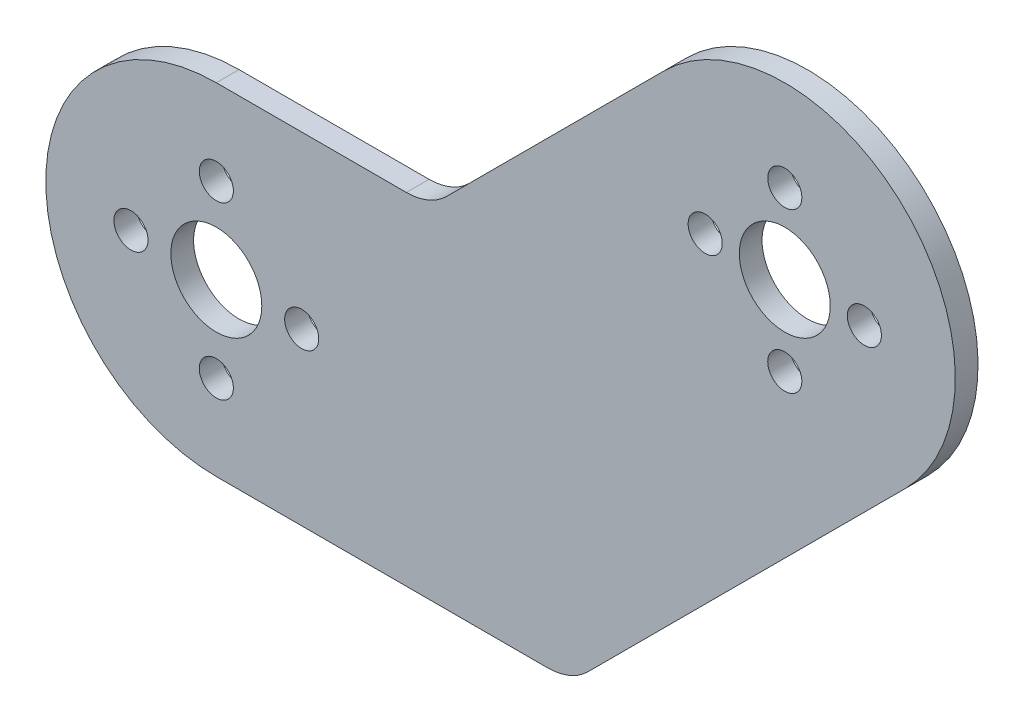
from build123d import *

# Parameters (mm, degrees)
SALIENTE_EXTRUIR1_DEPTH = 2
CROQUIS1_R              = 4
CORTAR_EXTRUIR1_DEPTH   = 2
CROQUIS2_R              = 1.5
CORTAR_EXTRUIR2_DEPTH   = 2
MATRIZC1_COUNT          = 4
CROQUIS4_R              = 4
CORTAR_EXTRUIR3_DEPTH   = 2
CROQUIS5_R              = 1.5
CORTAR_EXTRUIR4_DEPTH   = 2
MATRIZC2_COUNT          = 4


with BuildPart() as part:
    # Croquis3 → Saliente-Extruir1 (new body)
    with BuildSketch(Plane.XY):
        with BuildLine():
            Line((0, 15), (16.715728753, 15))
            ThreePointArc((16.715728753, 15), (18.629145914, 15.380602337), (20.251262658, 16.464466094))
            Line((20.251262658, 16.464466094), (39.393398282, 35.606601717))
            ThreePointArc((39.393398282, 35.606601717), (60.606601717, 35.606601717), (60.606601717, 14.393398282))
            Line((60.606601717, 14.393398282), (32.67766953, -13.535533906))
            ThreePointArc((32.67766953, -13.535533906), (31.055552786, -14.619397663), (29.142135624, -15))
            Line((29.142135624, -15), (0, -15))
            ThreePointArc((0, -15), (-15, 0), (0, 15))
        make_face()
    extrude(amount=SALIENTE_EXTRUIR1_DEPTH)

    # Croquis1 → Cortar-Extruir1 (cut)
    with BuildSketch(Plane.XY):
        Circle(CROQUIS1_R)
    extrude(amount=CORTAR_EXTRUIR1_DEPTH, mode=Mode.SUBTRACT)

    # Croquis2 → Cortar-Extruir2 (cut)
    with BuildSketch(Plane.XY):
        with Locations((0, 7.509798768)):
            Circle(CROQUIS2_R)
    cortar_extruir2 = extrude(amount=CORTAR_EXTRUIR2_DEPTH, mode=Mode.SUBTRACT)

    # MatrizC1: Cortar-Extruir2 ×4 about axis
    matrizc1_axis = Axis((0, 0, 0), (0, 0, 1))
    for i in range(1, MATRIZC1_COUNT):
        add(cortar_extruir2.rotate(matrizc1_axis, i * 360 / MATRIZC1_COUNT), mode=Mode.SUBTRACT)

    # Croquis4 → Cortar-Extruir3 (cut)
    with BuildSketch(Plane.XY.offset(2)):
        with Locations((50, 25)):
            Circle(CROQUIS4_R)
    extrude(amount=-CORTAR_EXTRUIR3_DEPTH, mode=Mode.SUBTRACT)

    # Croquis5 → Cortar-Extruir4 (cut)
    with BuildSketch(Plane.XY.offset(2)):
        with Locations((50, 32)):
            Circle(CROQUIS5_R)
    cortar_extruir4 = extrude(amount=-CORTAR_EXTRUIR4_DEPTH, mode=Mode.SUBTRACT)

    # MatrizC2: Cortar-Extruir4 ×4 about axis
    matrizc2_axis = Axis((50, 25, 0), (0, 0, 1))
    for i in range(1, MATRIZC2_COUNT):
        add(cortar_extruir4.rotate(matrizc2_axis, i * 360 / MATRIZC2_COUNT), mode=Mode.SUBTRACT)


solid = part.part
